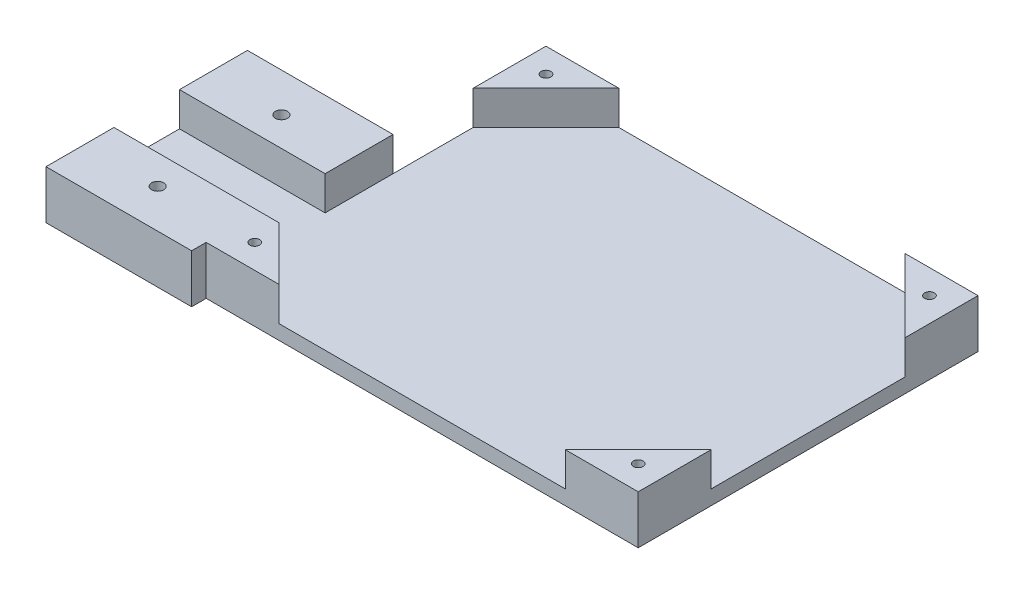
from build123d import *

# Parameters (mm, degrees)
SKETCH1_W           = 89
SKETCH1_H           = 70
SKETCH1_R           = 1
BOSS_EXTRUDE1_DEPTH = 10
CUT_EXTRUDE2_DEPTH  = 7
SKETCH6_W           = 30
SKETCH6_H           = 41.5
SKETCH6_R           = 1.25
BOSS_EXTRUDE2_DEPTH = 10
SKETCH7_W           = 34
SKETCH7_H           = 13.5
CUT_EXTRUDE3_DEPTH  = 7


with BuildPart() as part:
    # Sketch1 → Boss-Extrude1 (new body)
    with BuildSketch(Plane(origin=(0, 0, 0), x_dir=(1, 0, 0), z_dir=(0, 1, 0))):
        Rectangle(SKETCH1_W, SKETCH1_H)
        with Locations(Location((-39.5, 30, 0), (0, 0, 270))):
            Circle(SKETCH1_R, mode=Mode.SUBTRACT)
        with Locations(Location((39.5, 30, 0), (0, 0, 90))):
            Circle(SKETCH1_R, mode=Mode.SUBTRACT)
        with Locations(Location((39.5, -30, 0), (0, 0, 270))):
            Circle(SKETCH1_R, mode=Mode.SUBTRACT)
        with Locations(Location((-39.5, -30, 0), (0, 0, 90))):
            Circle(SKETCH1_R, mode=Mode.SUBTRACT)
    extrude(amount=BOSS_EXTRUDE1_DEPTH)

    # Sketch3 → Cut-Extrude2 (cut)
    with BuildSketch(Plane(origin=(0, 10, 0), x_dir=(1, 0, 0), z_dir=(0, 1, 0))):
        Polygon((-44.5, -20), (-29.5, -35), (29.5, -35), (44.5, -20), (44.5, 20), (29.5, 35), (-29.5, 35), (-44.5, 20), align=None)
    extrude(amount=-CUT_EXTRUDE2_DEPTH, mode=Mode.SUBTRACT)

    # Sketch6 → Boss-Extrude2 (add)
    with BuildSketch(Plane.XZ):
        with Locations((-59.5, 17.25)):
            Rectangle(SKETCH6_W, SKETCH6_H)
        with Locations(Location((-59.5, 30, 0), (0, 0, 270))):
            Circle(SKETCH6_R, mode=Mode.SUBTRACT)
        with Locations(Location((-59.5, 4.5, 0), (0, 0, 270))):
            Circle(SKETCH6_R, mode=Mode.SUBTRACT)
    extrude(amount=-BOSS_EXTRUDE2_DEPTH)

    # Sketch7 → Cut-Extrude3 (cut)
    with BuildSketch(Plane(origin=(0, 10, 0), x_dir=(1, 0, 0), z_dir=(0, 1, 0))):
        with Locations((-57.5, -17.25)):
            Rectangle(SKETCH7_W, SKETCH7_H)
    extrude(amount=-CUT_EXTRUDE3_DEPTH, mode=Mode.SUBTRACT)


solid = part.part
